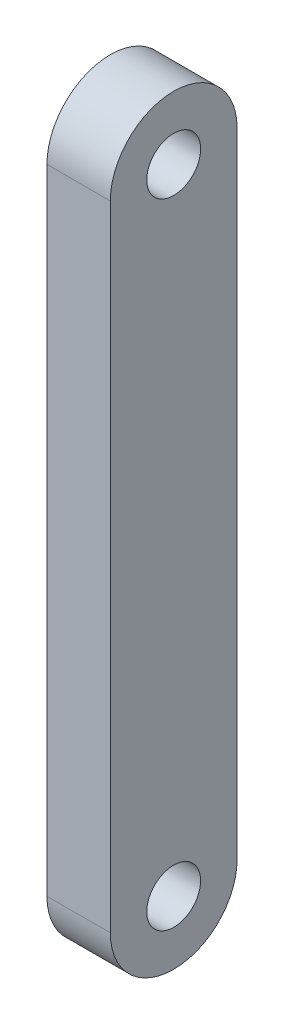
from build123d import *

# Parameters (mm, degrees)
CROQUIS1_R              = 4.25
SALIENTE_EXTRUIR1_DEPTH = 5


with BuildPart() as part:
    # Croquis1 → Saliente-Extruir1 (new, symmetric)
    with BuildSketch(Plane(origin=(0, 0, 0), x_dir=(0, 0, -1), z_dir=(1, 0, 0))):
        with BuildLine():
            Line((-10, -50), (-10, 50))
            ThreePointArc((-10, 50), (0, 60), (10, 50))
            Line((10, 50), (10, -50))
            ThreePointArc((10, -50), (0, -60), (-10, -50))
        make_face()
        with Locations((0, 50)):
            Circle(CROQUIS1_R, mode=Mode.SUBTRACT)
        with Locations((0, -50)):
            Circle(CROQUIS1_R, mode=Mode.SUBTRACT)
    extrude(amount=SALIENTE_EXTRUIR1_DEPTH, both=True)


solid = part.part
